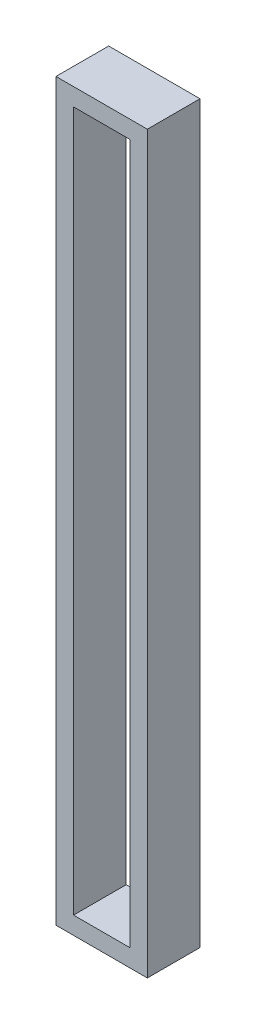
from build123d import *

# Parameters (mm, degrees)
SKETCH1_W           = 41.84
SKETCH1_H           = 5.2
SKETCH1_W_2         = 39.84
SKETCH1_H_2         = 3.2
BOSS_EXTRUDE1_DEPTH = 3


with BuildPart() as part:
    # Sketch1 → Boss-Extrude1 (new body)
    with BuildSketch(Plane(origin=(0, 0, 0), x_dir=(0, 1, 0), z_dir=(0, 0, 1))):
        with Locations((19.92, 1.6)):
            Rectangle(SKETCH1_W, SKETCH1_H)
        with Locations((19.92, 1.6)):
            Rectangle(SKETCH1_W_2, SKETCH1_H_2, mode=Mode.SUBTRACT)
    extrude(amount=BOSS_EXTRUDE1_DEPTH)


solid = part.part
